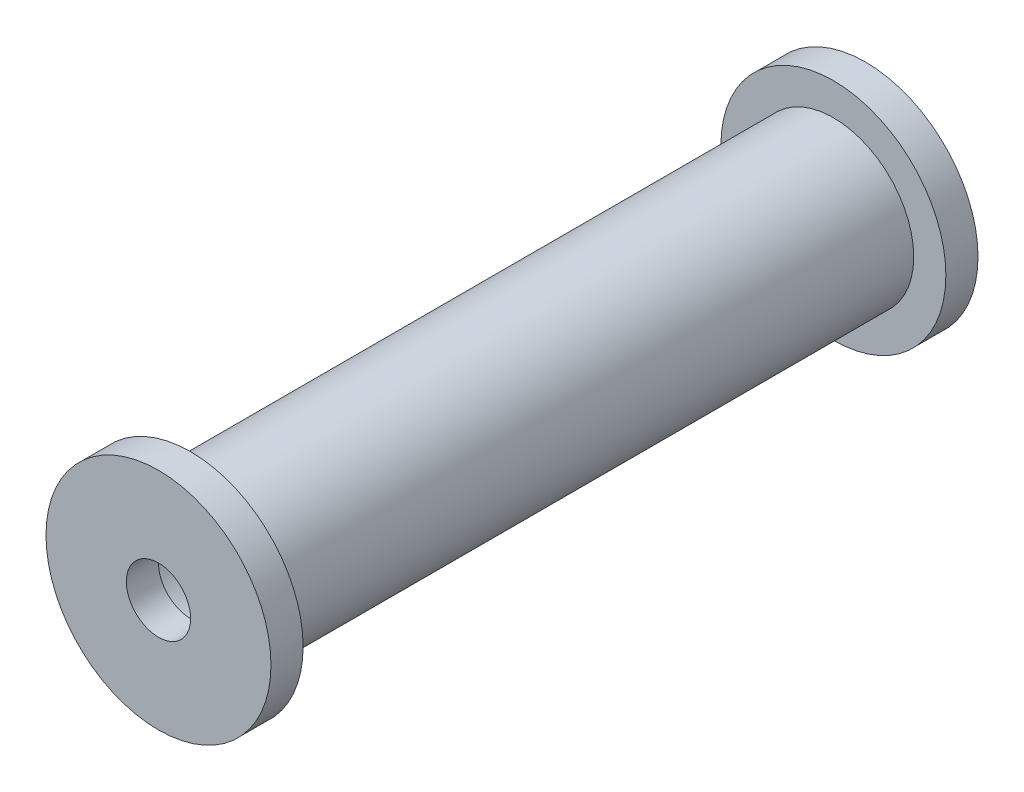
from build123d import *

# Parameters (mm, degrees)
SKETCH1_R           = 25
SKETCH1_R_2         = 20
BOSS_EXTRUDE2_DEPTH = 200
SKETCH4_R           = 35
SKETCH4_R_2         = 10
BOSS_EXTRUDE3_DEPTH = 10
BOSS_EXTRUDE4_START = 10
SKETCH5_R           = 35
SKETCH5_R_2         = 10
BOSS_EXTRUDE4_DEPTH = 10


with BuildPart() as part:
    # Sketch1 → Boss-Extrude2 (new body)
    with BuildSketch(Plane.XY):
        Circle(SKETCH1_R)
        Circle(SKETCH1_R_2, mode=Mode.SUBTRACT)
    extrude(amount=BOSS_EXTRUDE2_DEPTH)

    # Sketch4 → Boss-Extrude3 (add)
    with BuildSketch(Plane.XY.offset(200)):
        Circle(SKETCH4_R)
        Circle(SKETCH4_R_2, mode=Mode.SUBTRACT)
    extrude(amount=BOSS_EXTRUDE3_DEPTH)

    # Sketch5 → Boss-Extrude4 (add)
    with BuildSketch(Plane(origin=(0, 0, 0), x_dir=(-1, 0, 0), z_dir=(0, 0, -1)).offset(BOSS_EXTRUDE4_START)):
        with Locations(Location((0, 0, 0), (0, 0, 180))):
            Circle(SKETCH5_R)
        with Locations(Location((0, 0, 0), (0, 0, 180))):
            Circle(SKETCH5_R_2, mode=Mode.SUBTRACT)
    extrude(amount=-BOSS_EXTRUDE4_DEPTH)


solid = part.part
